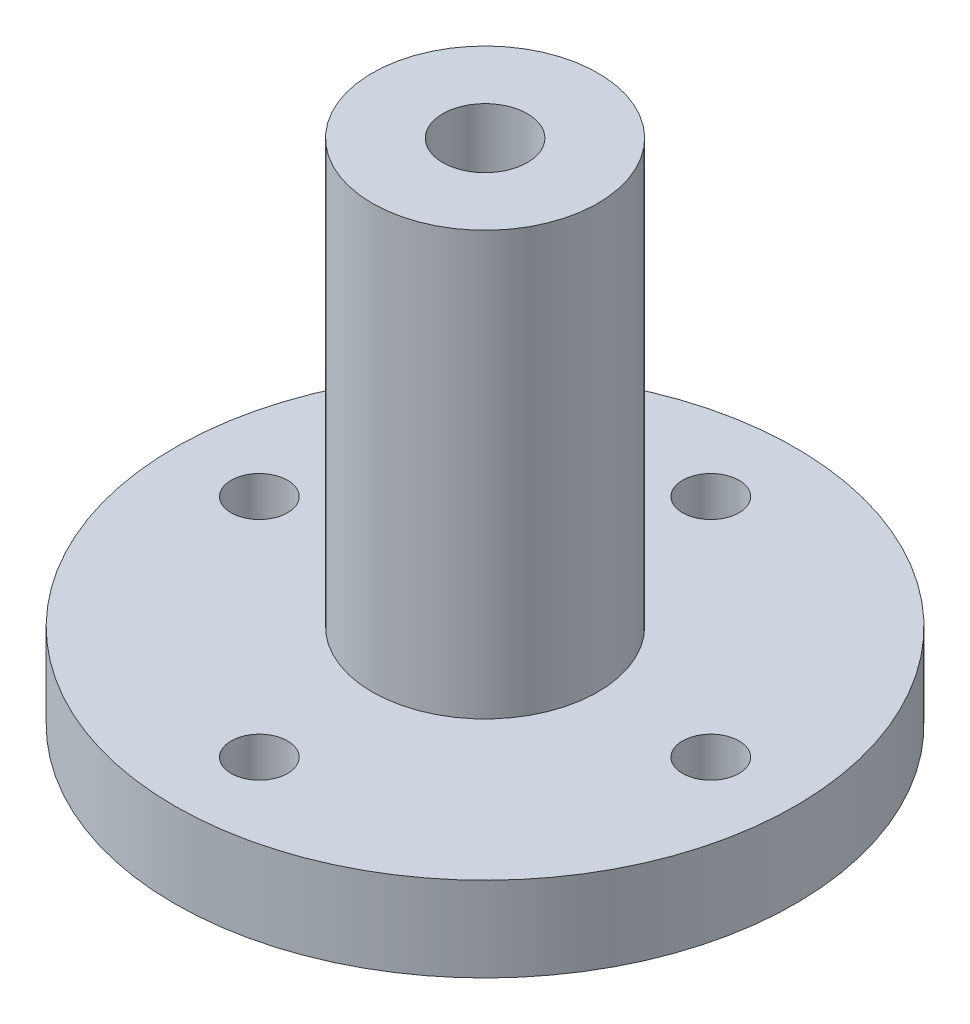
from build123d import *

# Parameters (mm, degrees)
SKETCH1_R           = 11
SKETCH1_R_2         = 1
BOSS_EXTRUDE1_DEPTH = 3
SKETCH2_R           = 4
BOSS_EXTRUDE2_DEPTH = 15
SKETCH3_R           = 1.5
CUT_EXTRUDE1_DEPTH  = 5


with BuildPart() as part:
    # Sketch1 → Boss-Extrude1 (new body)
    with BuildSketch(Plane(origin=(0, 0, 0), x_dir=(1, 0, 0), z_dir=(0, 1, 0))):
        with Locations(Location((0, 0, 0), (0, 0, 270))):
            Circle(SKETCH1_R)
        with Locations(Location((0, 8, 0), (0, 0, 270))):
            Circle(SKETCH1_R_2, mode=Mode.SUBTRACT)
        with Locations(Location((8, 0, 0), (0, 0, 270))):
            Circle(SKETCH1_R_2, mode=Mode.SUBTRACT)
        with Locations(Location((0, -8, 0), (0, 0, 270))):
            Circle(SKETCH1_R_2, mode=Mode.SUBTRACT)
        with Locations(Location((-8, 0, 0), (0, 0, 270))):
            Circle(SKETCH1_R_2, mode=Mode.SUBTRACT)
    extrude(amount=BOSS_EXTRUDE1_DEPTH)

    # Sketch2 → Boss-Extrude2 (add)
    with BuildSketch(Plane(origin=(0, 3, 0), x_dir=(1, 0, 0), z_dir=(0, 1, 0))):
        with Locations(Location((0, 0, 0), (0, 0, 270))):
            Circle(SKETCH2_R)
    extrude(amount=BOSS_EXTRUDE2_DEPTH)

    # Sketch3 → Cut-Extrude1 (cut)
    with BuildSketch(Plane(origin=(0, 18, 0), x_dir=(1, 0, 0), z_dir=(0, 1, 0))):
        with Locations(Location((0, 0, 0), (0, 0, 270))):
            Circle(SKETCH3_R)
    extrude(amount=-CUT_EXTRUDE1_DEPTH, mode=Mode.SUBTRACT)


solid = part.part
